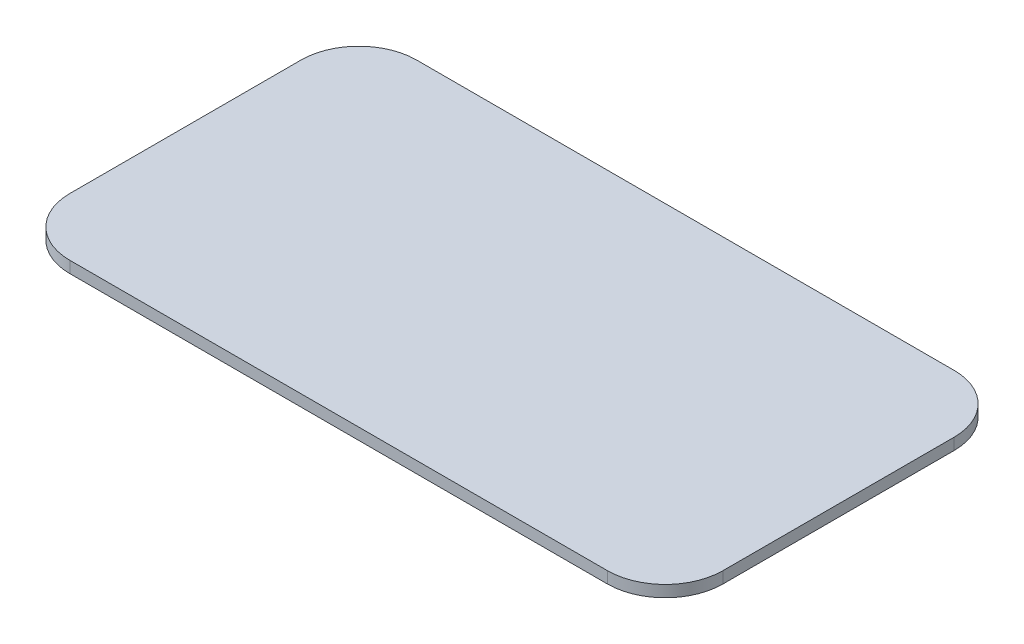
from build123d import *

# Parameters (mm, degrees)
RESSALTO_EXTRUS_O1_DEPTH = 2


with BuildPart() as part:
    # Esboço1 → Ressalto-extrusão1 (new body)
    with BuildSketch(Plane(origin=(0, 0, 0), x_dir=(1, 0, 0), z_dir=(0, 1, 0))):
        with BuildLine():
            Line((-13.214501511, 15.533232628), (79.785498489, 15.533232628))
            ThreePointArc((79.785498489, 15.533232628), (86.856566301, 12.60430044), (89.785498489, 5.533232628))
            Line((89.785498489, 5.533232628), (89.785498489, -34.466767372))
            ThreePointArc((89.785498489, -34.466767372), (86.856566301, -41.537835183), (79.785498489, -44.466767372))
            Line((79.785498489, -44.466767372), (-13.214501511, -44.466767372))
            ThreePointArc((-13.214501511, -44.466767372), (-20.285569322, -41.537835183), (-23.214501511, -34.466767372))
            Line((-23.214501511, -34.466767372), (-23.214501511, 5.533232628))
            ThreePointArc((-23.214501511, 5.533232628), (-20.285569322, 12.60430044), (-13.214501511, 15.533232628))
        make_face()
    extrude(amount=RESSALTO_EXTRUS_O1_DEPTH)


solid = part.part
